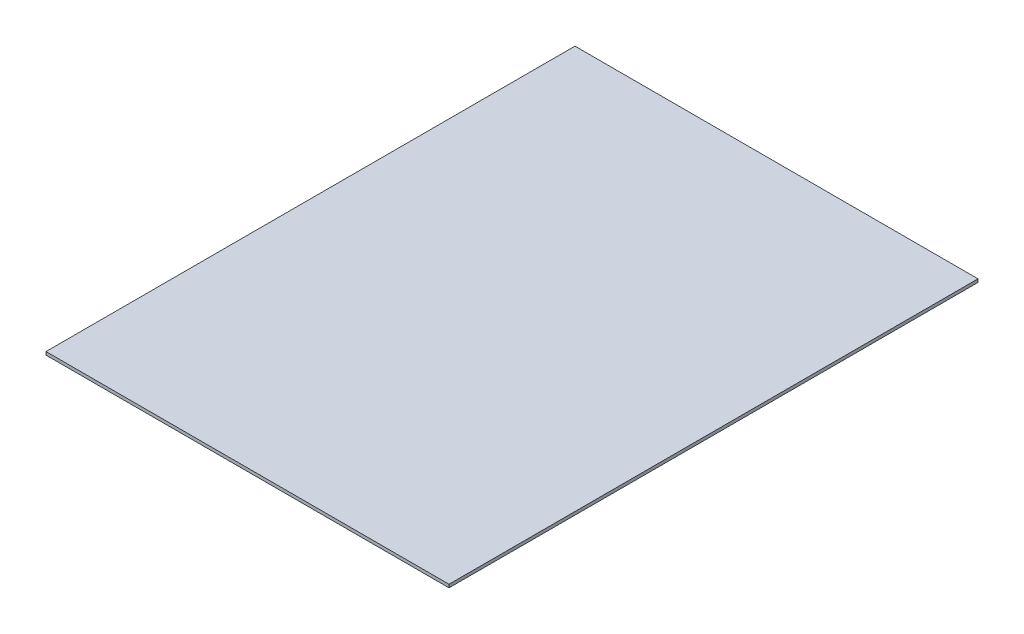
from build123d import *

# Parameters (mm, degrees)
SKETCH1_W           = 406.4
SKETCH1_H           = 533.4
BOSS_EXTRUDE1_DEPTH = 3.175


with BuildPart() as part:
    # Sketch1 → Boss-Extrude1 (new body)
    with BuildSketch(Plane(origin=(0, 0, 0), x_dir=(1, 0, 0), z_dir=(0, 1, 0))):
        Rectangle(SKETCH1_W, SKETCH1_H)
    extrude(amount=BOSS_EXTRUDE1_DEPTH)


solid = part.part
